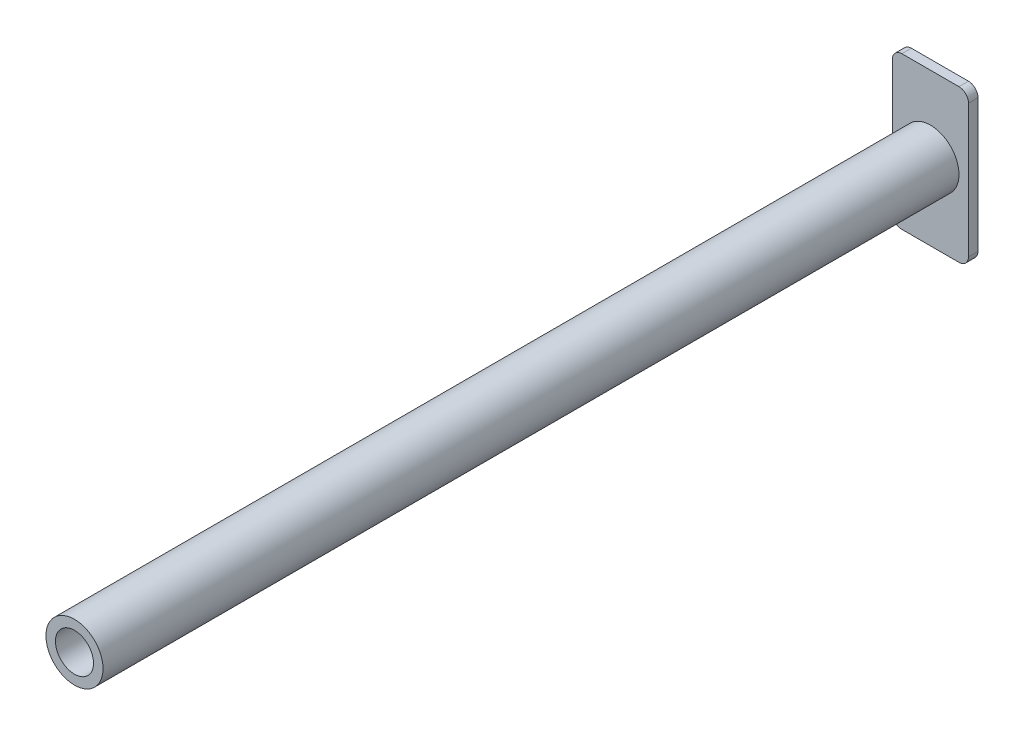
from build123d import *

# Parameters (mm, degrees)
PLATE_SKETCH_W      = 80
PLATE_SKETCH_H      = 160
PLATE_EXTRUDE_DEPTH = 10
PLATE_FILLET_R      = 10
POLE_SKETCH_R       = 30
POLE_SKETCH_R_2     = 20
POLE_EXTRUDE_DEPTH  = 900


with BuildPart() as part:
    # Plate Sketch → Plate Extrude (new body)
    with BuildSketch(Plane.XY):
        Rectangle(PLATE_SKETCH_W, PLATE_SKETCH_H)
    extrude(amount=PLATE_EXTRUDE_DEPTH)

    # Plate Fillet
    plate_fillet_edges = [part.edges().sort_by_distance(p)[0] for p in [
        (40, -80, 5),
        (-40, -80, 5),
        (-40, 80, 5),
        (40, 80, 5),
    ]]
    fillet(plate_fillet_edges, radius=PLATE_FILLET_R)

    # Pole Sketch → Pole Extrude (add)
    with BuildSketch(Plane.XY.offset(10)):
        Circle(POLE_SKETCH_R)
        Circle(POLE_SKETCH_R_2, mode=Mode.SUBTRACT)
    extrude(amount=POLE_EXTRUDE_DEPTH)


solid = part.part
